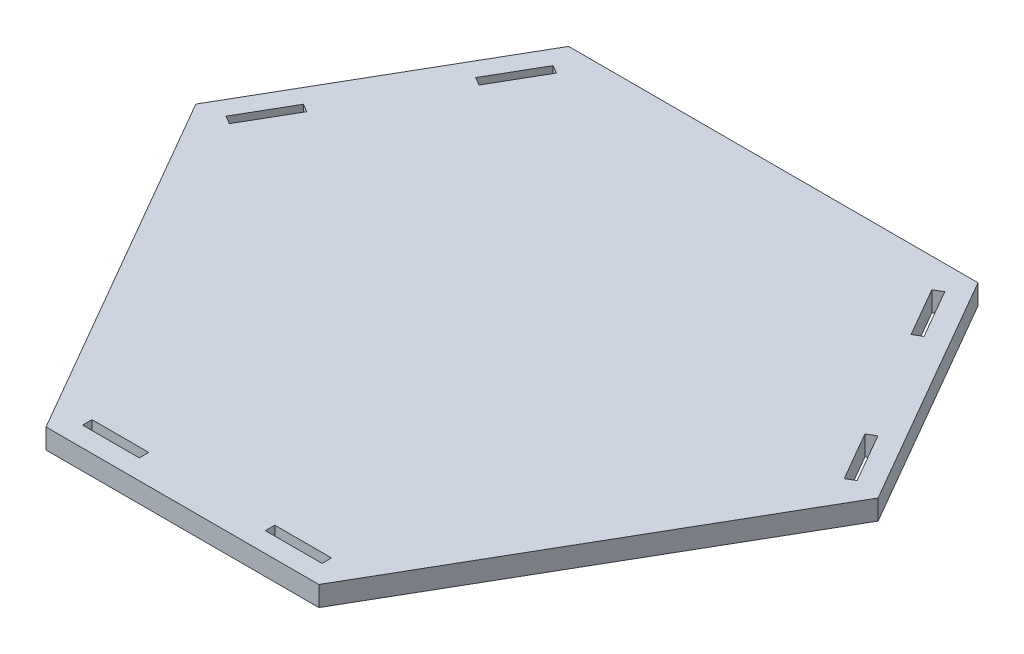
from build123d import *

# Parameters (mm, degrees)
BOSS_EXTRUDE1_DEPTH = 6.35
SKETCH2_W           = 18
SKETCH2_H           = 3
CUT_EXTRUDE1_DEPTH  = 148.509567486


with BuildPart() as part:
    # Sketch1 → Boss-Extrude1 (new body)
    with BuildSketch(Plane(origin=(0, 0, 0), x_dir=(1, 0, 0), z_dir=(0, 1, 0))):
        Polygon((64.951905284, 87.5), (-64.951905284, 87.5), (-108.253175473, 12.5), (-43.301270189, -100), (43.301270189, -100), (108.253175473, 12.5), align=None)
    extrude(amount=BOSS_EXTRUDE1_DEPTH)

    # Sketch2 → Cut-Extrude1 (cut, through all)
    with BuildSketch(Plane(origin=(0, 6.35, 0), x_dir=(1, 0, 0), z_dir=(0, 1, 0))):
        with Locations((-29, -92.2)):
            Rectangle(SKETCH2_W, SKETCH2_H)
        with Locations((29, -92.2)):
            Rectangle(SKETCH2_W, SKETCH2_H)
        Polygon((-62.146580335, 79.758965344), (-59.548504123, 78.258965344), (-68.548504123, 62.670508076), (-71.146580335, 64.170508076), align=None)
        Polygon((-97.548504123, 12.441034656), (-88.548504123, 28.029491924), (-91.146580335, 29.529491924), (-100.146580335, 13.941034656), align=None)
        Polygon((100.146580335, 13.941034656), (91.146580335, 29.529491924), (88.548504123, 28.029491924), (97.548504123, 12.441034656), align=None)
        Polygon((59.548504123, 78.258965344), (62.146580335, 79.758965344), (71.146580335, 64.170508076), (68.548504123, 62.670508076), align=None)
    extrude(amount=-CUT_EXTRUDE1_DEPTH, mode=Mode.SUBTRACT)


solid = part.part
